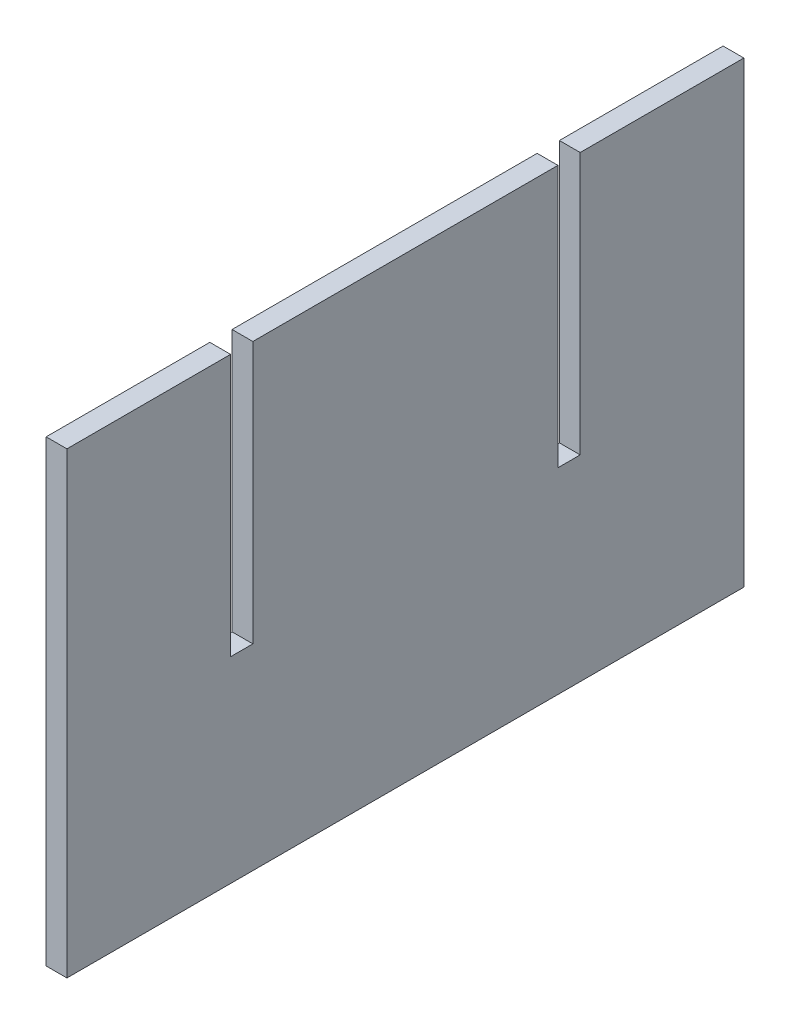
from build123d import *

# Parameters (mm, degrees)
BOSS_EXTRUDE1_DEPTH = 3.175


with BuildPart() as part:
    # Sketch1 → Boss-Extrude1 (new body)
    with BuildSketch(Plane(origin=(0, 0, 0), x_dir=(0, 0, -1), z_dir=(1, 0, 0))):
        Polygon((0, 0), (0, 70), (25, 70), (25, 30), (28.4, 30), (28.4, 70), (75, 70), (75, 30), (78.4, 30), (78.4, 70), (103.4, 70), (103.4, 0), align=None)
    extrude(amount=BOSS_EXTRUDE1_DEPTH)


solid = part.part
